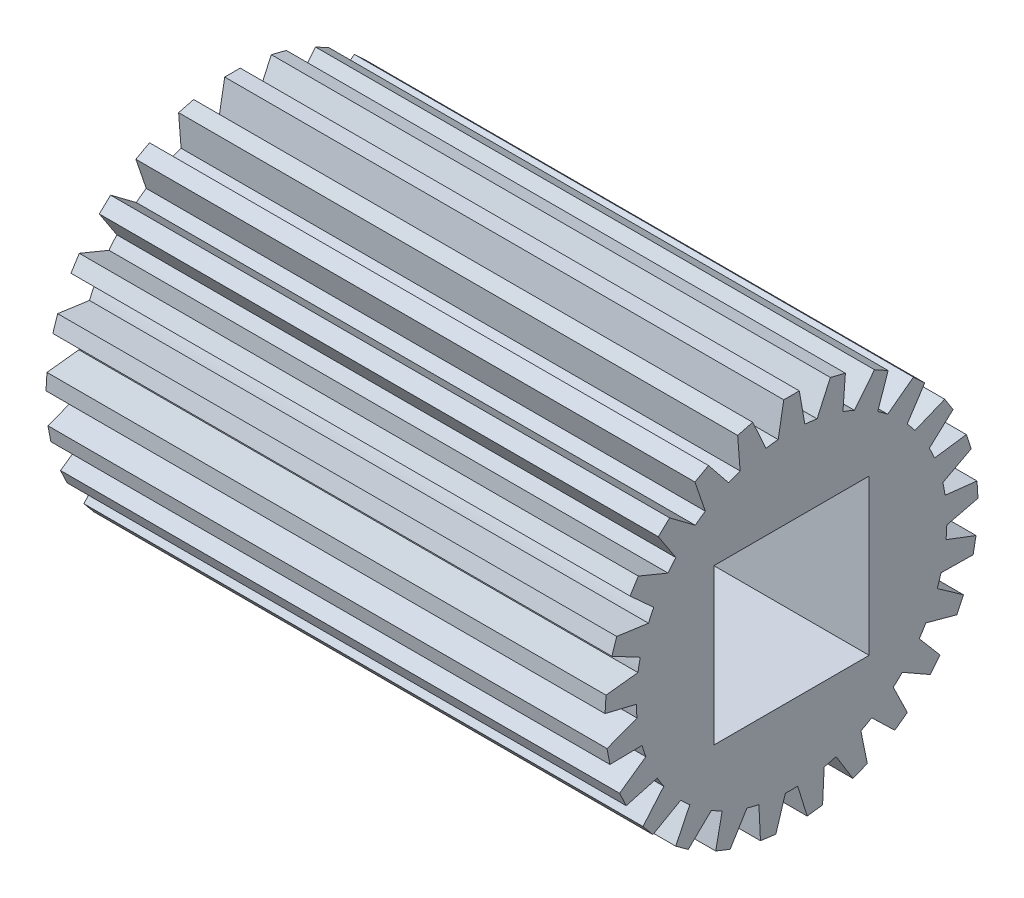
from build123d import *

# Parameters (mm, degrees)
BOSS_EXTRUDE2_START      = -13
BOSS_EXTRUDE2_DEPTH      = 18
BOSS_EXTRUDE3_DEPTH      = 5
BOSS_EXTRUDE3_DEPTH_BACK = 13
SKETCH3_R                = 5
CIRPATTERN1_COUNT        = 25
SKETCH4_W                = 5
SKETCH4_H                = 5
CUT_EXTRUDE1_DEPTH       = 18


with BuildPart() as part:
    # Sketch2 → Boss-Extrude2 (new body)
    with BuildSketch(Plane(origin=(0, 0, 0), x_dir=(0, 0, -1), z_dir=(1, 0, 0)).offset(BOSS_EXTRUDE2_START)):
        with BuildLine():
            ThreePointArc((0.429587035, 4.981511315), (0, 5), (-0.429587035, 4.981511315))
            Line((-0.429587035, 4.981511315), (-0.700772987, 3.443539352))
            Line((-0.700772987, 3.443539352), (0.700772987, 3.443539352))
            Line((0.700772987, 3.443539352), (0.429587035, 4.981511315))
        make_face()
        with BuildLine():
            Line((0.25, 6), (-0.25, 6))
            Line((-0.25, 6), (-0.429587035, 4.981511315))
            ThreePointArc((-0.429587035, 4.981511315), (0, 5), (0.429587035, 4.981511315))
            Line((0.429587035, 4.981511315), (0.25, 6))
        make_face()
    boss_extrude2 = extrude(amount=BOSS_EXTRUDE2_DEPTH)

    # Sketch3 → Boss-Extrude3 (add, two sides: drawn at the far end of the back side and taken through both)
    with BuildSketch(Plane(origin=(0, 0, 0), x_dir=(0, 0, -1), z_dir=(1, 0, 0)).offset(-BOSS_EXTRUDE3_DEPTH_BACK)):
        Circle(SKETCH3_R)
    extrude(amount=BOSS_EXTRUDE3_DEPTH + BOSS_EXTRUDE3_DEPTH_BACK)

    # CirPattern1: Boss-Extrude2 ×25 about axis
    cirpattern1_axis = Axis((0, 0, 0), (1, 0, 0))
    for i in range(1, CIRPATTERN1_COUNT):
        add(boss_extrude2.rotate(cirpattern1_axis, i * 360 / CIRPATTERN1_COUNT))

    # Sketch4 → Cut-Extrude1 (cut)
    with BuildSketch(Plane(origin=(5, 0, 0), x_dir=(0, 0, -1), z_dir=(1, 0, 0))):
        Rectangle(SKETCH4_W, SKETCH4_H)
    extrude(amount=-CUT_EXTRUDE1_DEPTH, mode=Mode.SUBTRACT)


solid = part.part
